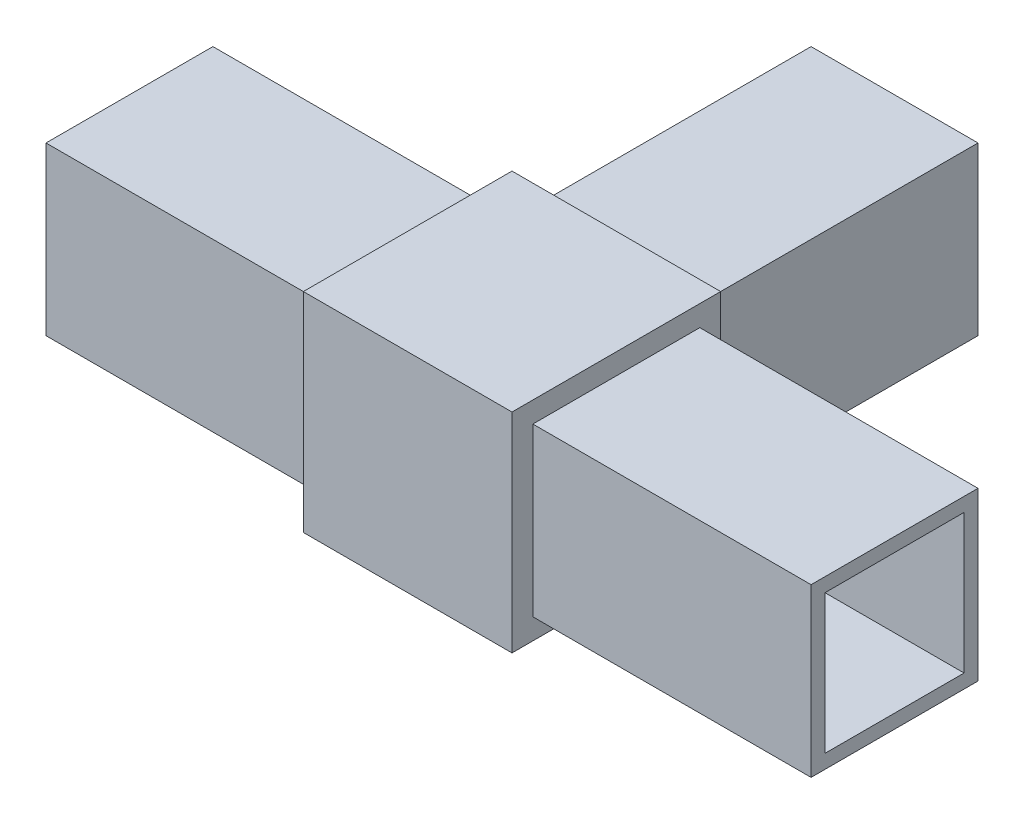
from build123d import *

# Parameters (mm, degrees)
CROQUIS1_W     = 30
CROQUIS1_H     = 40
CROQUIS1_H_2   = 30
CROQUIS1_W_2   = 40
EXTRUIR1_DEPTH = 30
CROQUIS2_W     = 30
CROQUIS2_H     = 30
CROQUIS2_W_2   = 24
CROQUIS2_H_2   = 24
EXTRUIR2_DEPTH = 40
CROQUIS3_W     = 30
CROQUIS3_H     = 30
CROQUIS3_W_2   = 24
CROQUIS3_H_2   = 24
EXTRUIR3_DEPTH = 40
CROQUIS5_W     = 30
CROQUIS5_H     = 30
CROQUIS5_W_2   = 24
CROQUIS5_H_2   = 24
EXTRUIR4_DEPTH = 40
VACIADO1_T     = -2


with BuildPart() as part:
    # Croquis1 → Extruir1 (new body)
    with BuildSketch(Plane(origin=(0, 0, 0), x_dir=(1, 0, 0), z_dir=(0, 1, 0))):
        with Locations((0, 35)):
            Rectangle(CROQUIS1_W, CROQUIS1_H)
        Rectangle(CROQUIS1_W, CROQUIS1_H_2)
        with Locations((35, 0)):
            Rectangle(CROQUIS1_W_2, CROQUIS1_H_2)
        with Locations((-35, 0)):
            Rectangle(CROQUIS1_W_2, CROQUIS1_H_2)
    extrude(amount=EXTRUIR1_DEPTH)

    # Croquis2 → Extruir2 (cut)
    with BuildSketch(Plane(origin=(55, 0, 0), x_dir=(0, 0, -1), z_dir=(1, 0, 0))):
        with Locations((0, 15)):
            Rectangle(CROQUIS2_W, CROQUIS2_H)
        with Locations((0, 15)):
            Rectangle(CROQUIS2_W_2, CROQUIS2_H_2, mode=Mode.SUBTRACT)
    extrude(amount=-EXTRUIR2_DEPTH, mode=Mode.SUBTRACT)

    # Croquis3 → Extruir3 (cut)
    with BuildSketch(Plane(origin=(0, 0, -55), x_dir=(-1, 0, 0), z_dir=(0, 0, -1))):
        with Locations((0, 15)):
            Rectangle(CROQUIS3_W, CROQUIS3_H)
        with Locations((0, 15)):
            Rectangle(CROQUIS3_W_2, CROQUIS3_H_2, mode=Mode.SUBTRACT)
    extrude(amount=-EXTRUIR3_DEPTH, mode=Mode.SUBTRACT)

    # Croquis5 → Extruir4 (cut)
    with BuildSketch(Plane.ZY.offset(55)):
        with Locations((0, 15)):
            Rectangle(CROQUIS5_W, CROQUIS5_H)
        with Locations((0, 15)):
            Rectangle(CROQUIS5_W_2, CROQUIS5_H_2, mode=Mode.SUBTRACT)
    extrude(amount=-EXTRUIR4_DEPTH, mode=Mode.SUBTRACT)

    # Vaciado1
    vaciado1_openings = [part.faces().sort_by_distance(p)[0] for p in [
        (55, 15, 0),
        (0, 15, -55),
        (-55, 15, 0),
    ]]
    offset(amount=VACIADO1_T, openings=vaciado1_openings, kind=Kind.INTERSECTION)


solid = part.part
